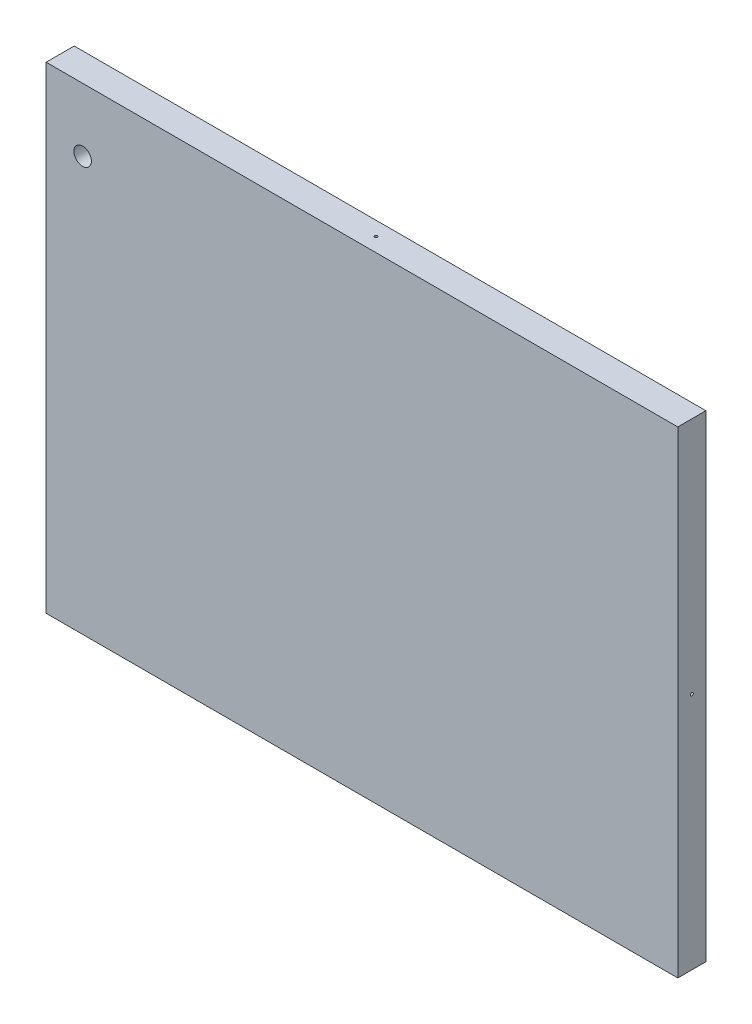
from build123d import *

# Parameters (mm, degrees)
SKETCH_2_W          = 900
SKETCH_2_H          = 680
EXTRUDE_1_DEPTH     = 40
HOLE_WIZARD_M5_1_D  = 4.2
HOLE_WIZARD_M5_2_D  = 4.2
SKETCH_9_R          = 12.5
CUT_EXTRUDE_1_DEPTH = 566.420197729


with BuildPart() as part:
    # 草图2 → 凸台-拉伸1 (new body)
    with BuildSketch(Plane.XY):
        Rectangle(SKETCH_2_W, SKETCH_2_H)
    extrude(amount=EXTRUDE_1_DEPTH)

    # M5 螺纹孔1 (through all)
    with Locations(Plane(origin=(0, -340, 0), x_dir=(-1, 0, 0), z_dir=(0, -1, 0))):
        with Locations((0, -20)):
            Hole(HOLE_WIZARD_M5_1_D / 2)

    # M5 螺纹孔2 (through all)
    with Locations(Plane.ZY.offset(450)):
        with Locations((20, 0)):
            Hole(HOLE_WIZARD_M5_2_D / 2)

    # 草图9 → 切除-拉伸1 (cut, through all)
    with BuildSketch(Plane.XY.offset(40)):
        with Locations((-398, 250)):
            Circle(SKETCH_9_R)
    extrude(amount=-CUT_EXTRUDE_1_DEPTH, mode=Mode.SUBTRACT)


solid = part.part
